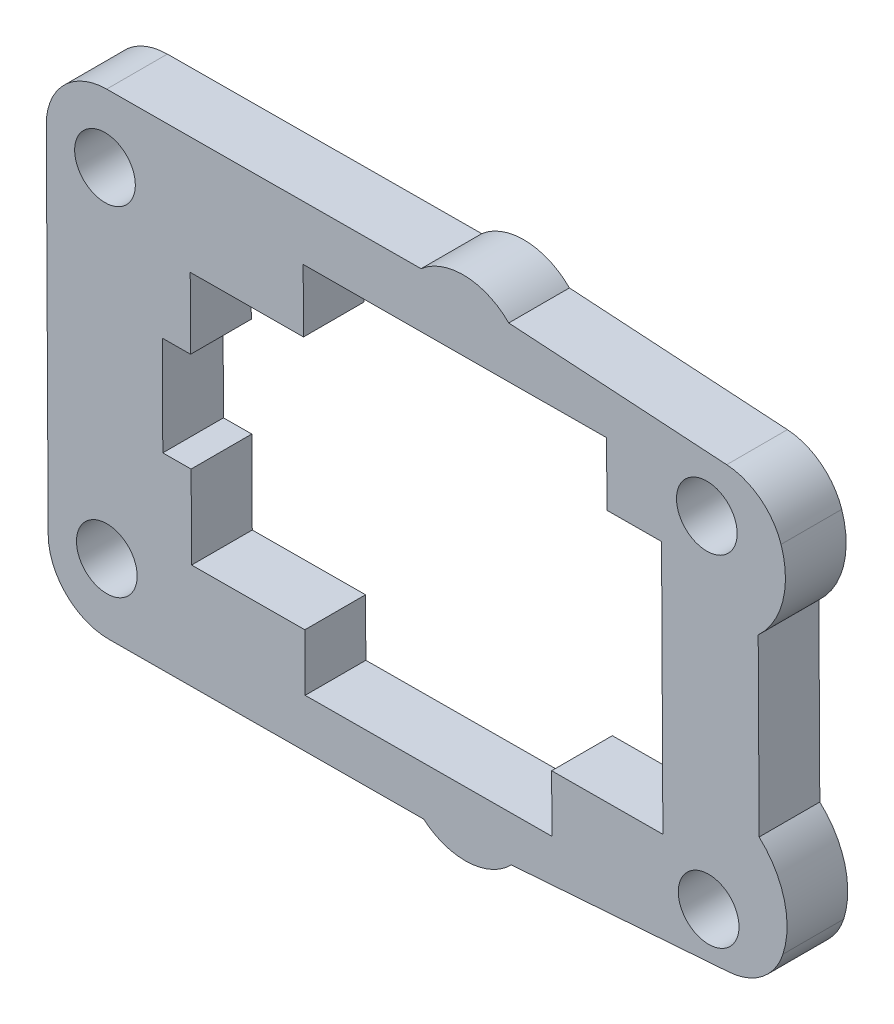
from build123d import *

# Parameters (mm, degrees)
SKETCH1_R           = 1.5
BOSS_EXTRUDE1_DEPTH = 3


with BuildPart() as part:
    # Sketch1 → Boss-Extrude1 (new body)
    with BuildSketch(Plane.XY):
        with BuildLine():
            Line((15.435057436, 20.921377099), (-0.10870117, 20.838196592))
            ThreePointArc((-0.10870117, 20.838196592), (-2.225289061, 19.948177695), (-3.092604315, 17.822185647))
            Line((-3.092604315, 17.822185647), (-2.998956565, 0.322436217))
            ThreePointArc((-2.998956565, 0.322436217), (-2.108937668, -1.794151674), (0.01705438, -2.661466928))
            Line((0.01705438, -2.661466928), (15.560812986, -2.578286421))
            ThreePointArc((15.560812986, -2.578286421), (17.766430895, -3.332819275), (19.891460268, -2.374528948))
            Line((19.891460268, -2.374528948), (30.659457178, -1.580311749))
            ThreePointArc((30.659457178, -1.580311749), (32.311987692, -0.938952483), (33.323696389, 0.516603879))
            ThreePointArc((33.323696389, 0.516603879), (33.38449749, 2.903690209), (32.146093551, 4.945315446))
            Line((32.146093551, 4.945315446), (32.099909063, 13.575709212))
            ThreePointArc((32.099909063, 13.575709212), (33.31639169, 15.630471471), (33.230046407, 18.016770366))
            ThreePointArc((33.230046407, 18.016770366), (32.202817639, 19.461415605), (30.543517656, 20.085052019))
            Line((30.543517656, 20.085052019), (19.767637393, 20.763979817))
            ThreePointArc((19.767637393, 20.763979817), (17.632473675, 21.699472247), (15.435057436, 20.921377099))
        make_face()
        with Locations((29.560164558, 17.392133017)):
            Circle(SKETCH1_R, mode=Mode.SUBTRACT)
        with Locations((29.65, 0.604781235)):
            Circle(SKETCH1_R, mode=Mode.SUBTRACT)
        with Locations((-0.101138608, 0.73794926)):
            Circle(SKETCH1_R, mode=Mode.SUBTRACT)
        with Locations((-0.190505318, 17.437710144)):
            Circle(SKETCH1_R, mode=Mode.SUBTRACT)
        Polygon((2.641027261, 11.552778262), (2.667248631, 6.652848422), (4.067228585, 6.660340242), (4.089168915, 2.560398947), (9.689088733, 2.590366227), (9.704072373, -0.209593682), (21.903897689, -0.144307821), (21.888914049, 2.655652087), (27.388835298, 2.685084237), (27.321944048, 15.184905259), (24.621982708, 15.170456748), (24.605393678, 18.270412362), (9.605608452, 18.190142862), (9.622197482, 15.090187248), (4.022277665, 15.060219968), (4.041007215, 11.560270082), align=None, mode=Mode.SUBTRACT)
    extrude(amount=BOSS_EXTRUDE1_DEPTH)


solid = part.part
